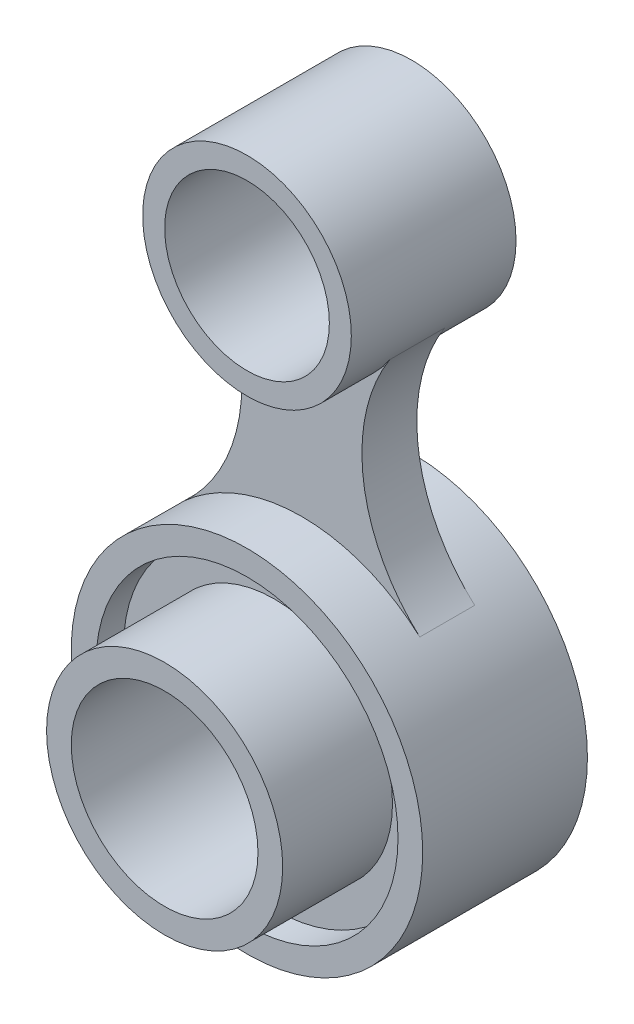
from build123d import *

# Parameters (mm, degrees)
SKETCH1_R           = 32
BOSS_EXTRUDE3_DEPTH = 45
SKETCH4_R           = 17
CUT_EXTRUDE1_DEPTH  = 45
CUT_EXTRUDE2_START  = -15
SKETCH5_R           = 32
SKETCH5_R_2         = 21.5
CUT_EXTRUDE2_DEPTH  = 15
CUT_EXTRUDE3_START  = -5
SKETCH6_R           = 27.5
SKETCH6_R_2         = 21.5
CUT_EXTRUDE3_DEPTH  = 5
SKETCH7_R           = 19
SKETCH7_R_2         = 15
BOSS_EXTRUDE4_DEPTH = 30
BOSS_EXTRUDE5_START = 10
BOSS_EXTRUDE5_DEPTH = 10


with BuildPart() as part:
    # Sketch1 → Boss-Extrude3 (new body)
    with BuildSketch(Plane.XY):
        with Locations(Location((0, 0, 0), (0, 0, 180))):
            Circle(SKETCH1_R)
    extrude(amount=BOSS_EXTRUDE3_DEPTH)

    # Sketch4 → Cut-Extrude1 (cut)
    with BuildSketch(Plane.XY.offset(45)):
        Circle(SKETCH4_R)
    extrude(amount=-CUT_EXTRUDE1_DEPTH, mode=Mode.SUBTRACT)

    # Sketch5 → Cut-Extrude2 (cut)
    with BuildSketch(Plane.XY.offset(45).offset(CUT_EXTRUDE2_START)):
        with Locations(Location((0, 0, 0), (0, 0, 180))):
            Circle(SKETCH5_R)
        Circle(SKETCH5_R_2, mode=Mode.SUBTRACT)
    extrude(amount=CUT_EXTRUDE2_DEPTH, mode=Mode.SUBTRACT)

    # Sketch6 → Cut-Extrude3 (cut)
    with BuildSketch(Plane.XY.offset(30).offset(CUT_EXTRUDE3_START)):
        Circle(SKETCH6_R)
        Circle(SKETCH6_R_2, mode=Mode.SUBTRACT)
    extrude(amount=CUT_EXTRUDE3_DEPTH, mode=Mode.SUBTRACT)



with BuildPart() as body_2:
    # Sketch7 → Boss-Extrude4 (new body)
    with BuildSketch(Plane.XY):
        with Locations((0, 75)):
            Circle(SKETCH7_R)
        with Locations((0, 75)):
            Circle(SKETCH7_R_2, mode=Mode.SUBTRACT)
    extrude(amount=BOSS_EXTRUDE4_DEPTH)


with BuildPart() as part_1:
    add(part.part)

    add(body_2.part)  # Boss-Extrude5 merges body 2
    # Sketch8 → Boss-Extrude5 (add)
    with BuildSketch(Plane.XY.offset(BOSS_EXTRUDE5_START)):
        with BuildLine():
            ThreePointArc((15.993228521, 64.74248366), (11.210252348, 43.234782297), (21.464596173, 23.733333333))
            ThreePointArc((21.464596173, 23.733333333), (0, 32), (-21.464596173, 23.733333333))
            ThreePointArc((-21.464596173, 23.733333333), (-11.210252348, 43.234782297), (-15.993228521, 64.74248366))
            ThreePointArc((-15.993228521, 64.74248366), (0, 56), (15.993228521, 64.74248366))
        make_face()
    extrude(amount=BOSS_EXTRUDE5_DEPTH)


solid = part_1.part
